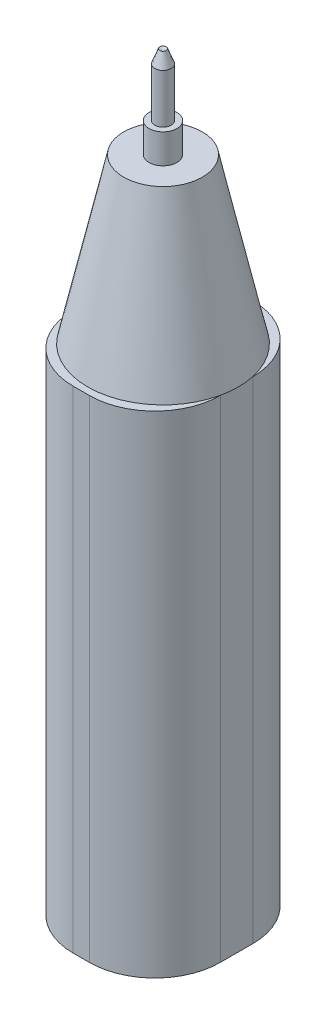
from build123d import *

# Parameters (mm, degrees)
SALIENTE_EXTRUIR1_DEPTH = 150
CROQUIS5_R              = 4.25
SALIENTE_EXTRUIR3_DEPTH = 9
CROQUIS6_R              = 2.5
SALIENTE_EXTRUIR4_DEPTH = 15


with BuildPart() as part:
    # Croquis1 → Saliente-Extruir1 (new body)
    with BuildSketch(Plane(origin=(0, 0, 0), x_dir=(1, 0, 0), z_dir=(0, 1, 0))):
        with BuildLine():
            Line((-2.5, -25), (2.5, -25))
            ThreePointArc((2.5, -25), (16.642135624, -19.142135624), (22.5, -5))
            Line((22.5, -5), (22.5, 5))
            ThreePointArc((22.5, 5), (16.642135624, 19.142135624), (2.5, 25))
            Line((2.5, 25), (-2.5, 25))
            ThreePointArc((-2.5, 25), (-16.642135624, 19.142135624), (-22.5, 5))
            Line((-22.5, 5), (-22.5, -5))
            ThreePointArc((-22.5, -5), (-16.642135624, -19.142135624), (-2.5, -25))
        make_face()
    extrude(amount=SALIENTE_EXTRUIR1_DEPTH)

    # Croquis4 → Revolución-Lámina1 (revolve)
    with BuildSketch(Plane(origin=(0, 0, 0), x_dir=(0, 0, -1), z_dir=(1, 0, 0)), mode=Mode.PRIVATE) as revoluci_n_l_mina1_sk:
        Polygon((-23, 150), (-12, 200), (0, 200), (0, 190), (-3.960859411, 190), (-13.233555333, 147.851382173), align=None)
    revolve(revoluci_n_l_mina1_sk.sketch.rotate(Axis((0, 150, 0), (0, 1, 0)), 180), axis=Axis((0, 150, 0), (0, 1, 0)))

    # Croquis5 → Saliente-Extruir3 (add)
    with BuildSketch(Plane(origin=(0, 200, 0), x_dir=(1, 0, 0), z_dir=(0, 1, 0))):
        with Locations(Location((0, 0, 0), (0, 0, 270))):
            Circle(CROQUIS5_R)
    extrude(amount=SALIENTE_EXTRUIR3_DEPTH)

    # Croquis6 → Saliente-Extruir4 (add)
    with BuildSketch(Plane(origin=(0, 209, 0), x_dir=(1, 0, 0), z_dir=(0, 1, 0))):
        with Locations(Location((0, 0, 0), (0, 0, 270))):
            Circle(CROQUIS6_R)
    extrude(amount=SALIENTE_EXTRUIR4_DEPTH)

    # Croquis7 → Revolución-Lámina4 (revolve)
    with BuildSketch(Plane(origin=(0, 0, 0), x_dir=(0, 0, -1), z_dir=(1, 0, 0))):
        Polygon((-2.5, 224), (-1, 228), (-0.063670822, 227.648876558), (-1.563670822, 223.648876558), align=None)
    revolve(axis=Axis((0, 228, 0), (0, -1, 0)))


solid = part.part
